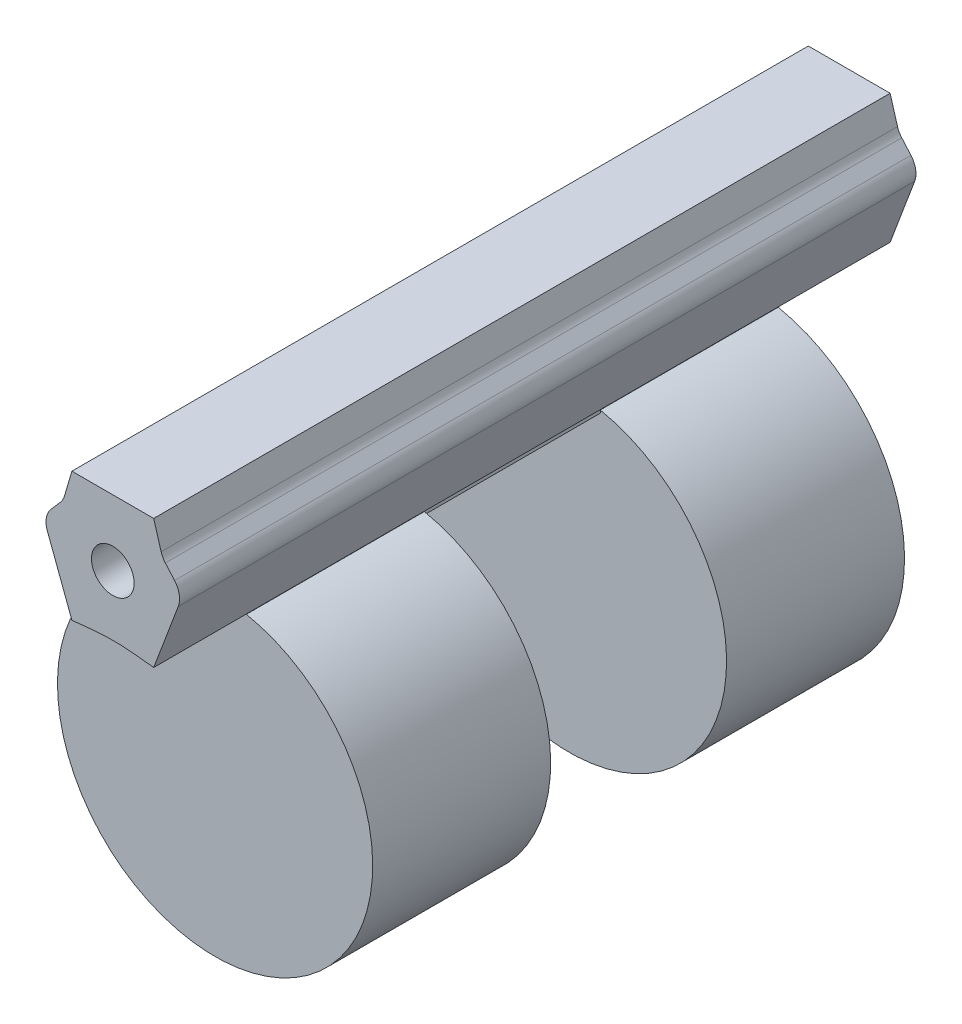
from build123d import *

# Parameters (mm, degrees)
CROQUIS1_R              = 7.705
SALIENTE_EXTRUIR1_DEPTH = 4.35
SALIENTE_EXTRUIR2_START = -13.5
SALIENTE_EXTRUIR2_DEPTH = 18.5
SALIENTE_EXTRUIR3_DEPTH = 13.5
CROQUIS5_R              = 1.042712332
CORTAR_EXTRUIR1_DEPTH   = 2.5


with BuildPart() as part:
    # Croquis1 → Saliente-Extruir1 (new, symmetric)
    with BuildSketch(Plane.XY):
        Circle(CROQUIS1_R)
    saliente_extruir1 = extrude(amount=SALIENTE_EXTRUIR1_DEPTH, both=True)



with BuildPart() as body_2:
    # Croquis3 → Saliente-Extruir2 (new body)
    with BuildSketch(Plane.XY.offset(4.35).offset(SALIENTE_EXTRUIR2_START)):
        with BuildLine():
            Line((2, 8.034909184), (1.02204697, 8.135386739))
            ThreePointArc((1.02204697, 8.135386739), (0, 8.18775285), (-1.02204697, 8.135386739))
            Line((-1.02204697, 8.135386739), (-2, 8.034909184))
            Line((-2, 8.034909184), (-3.200003677, 11.21841322))
            ThreePointArc((-3.200003677, 11.21841322), (-3.248411026, 11.748541167), (-3.017934695, 12.228394865))
            Line((-3.017934695, 12.228394865), (-2.568482545, 12.743765532))
            ThreePointArc((-2.568482545, 12.743765532), (-2.445625709, 12.919659287), (-2.363117092, 13.117711661))
            Line((-2.363117092, 13.117711661), (-2, 14.346858197))
            Line((-2, 14.346858197), (2, 14.346858197))
            Line((2, 14.346858197), (2.363117092, 13.117711661))
            ThreePointArc((2.363117092, 13.117711661), (2.445625709, 12.919659287), (2.568482545, 12.743765532))
            Line((2.568482545, 12.743765532), (3.017934695, 12.228394865))
            ThreePointArc((3.017934695, 12.228394865), (3.248411026, 11.748541167), (3.200003677, 11.21841322))
            Line((3.200003677, 11.21841322), (2, 8.034909184))
        make_face()
    saliente_extruir2 = extrude(amount=SALIENTE_EXTRUIR2_DEPTH)


with BuildPart() as part_1:
    add(part.part)

    add(body_2.part)  # Saliente-Extruir3 merges body 2
    # Croquis4 → Saliente-Extruir3 (add)
    with BuildSketch(Plane.XY.offset(4.35)):
        with BuildLine():
            Line((1.529777798, 7.551609424), (1.529777798, 8.083221093))
            ThreePointArc((1.529777798, 8.083221093), (0, 8.18775285), (-1.529777798, 8.083221093))
            Line((-1.529777798, 8.083221093), (-1.529777798, 7.551609424))
            Line((-1.529777798, 7.551609424), (-1.529777798, 7.414435005))
            ThreePointArc((-1.529777798, 7.414435005), (0, 7.562302456), (1.529777798, 7.414435005))
            Line((1.529777798, 7.414435005), (1.529777798, 7.551609424))
        make_face()
    saliente_extruir3 = extrude(amount=-SALIENTE_EXTRUIR3_DEPTH)

    # Simetría2: Saliente-Extruir2, Saliente-Extruir3 across plane
    add(saliente_extruir2.mirror(Plane.XY.offset(-8.65)))
    add(saliente_extruir3.mirror(Plane.XY.offset(-8.65)))

    # Simetría3: Saliente-Extruir1 across plane
    add(saliente_extruir1.mirror(Plane.XY.offset(-8.65)))

    # Croquis5 → Cortar-Extruir1 (cut)
    with BuildSketch(Plane.XY.offset(9.35)):
        with Locations((0, 11.126169976)):
            Circle(CROQUIS5_R)
    cortar_extruir1 = extrude(amount=-CORTAR_EXTRUIR1_DEPTH, mode=Mode.SUBTRACT)

    # Simetría4: Cortar-Extruir1 across plane
    add(cortar_extruir1.mirror(Plane.XY.offset(-8.65)), mode=Mode.SUBTRACT)


solid = part_1.part
